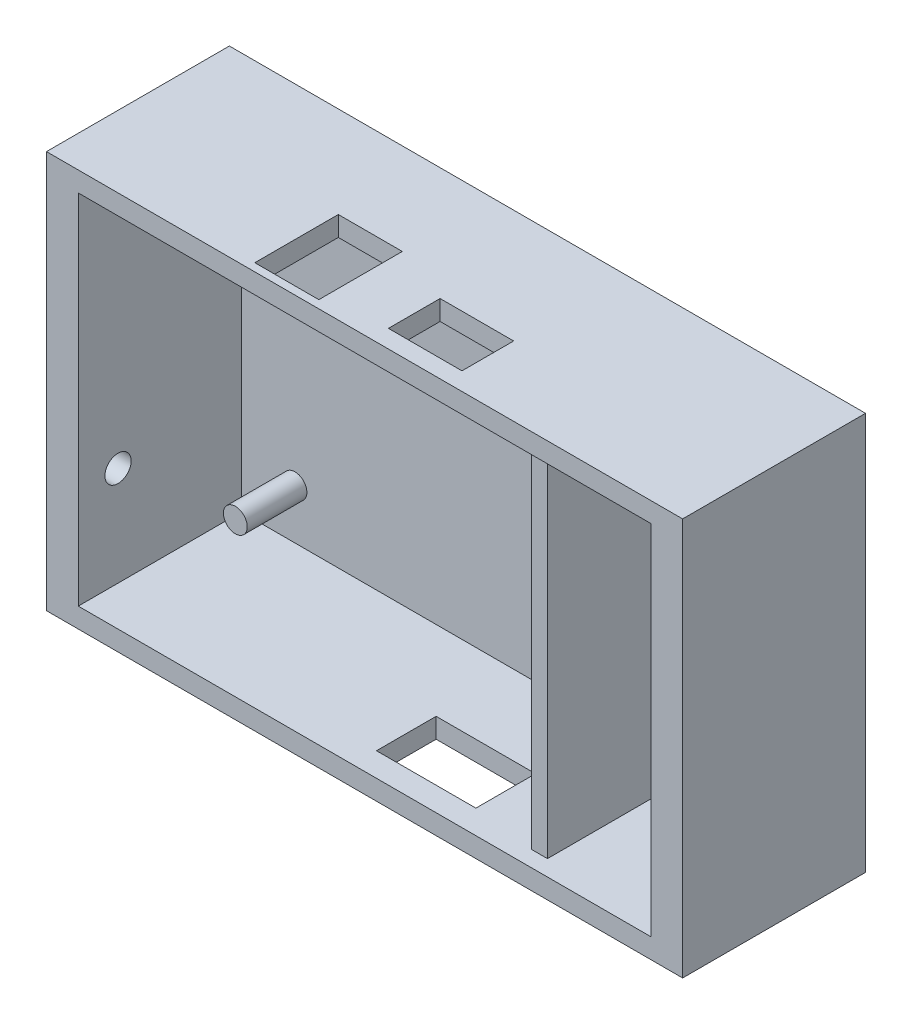
from build123d import *

# Parameters (mm, degrees)
ESQUISSE1_W                       = 160
ESQUISSE1_H                       = 100
ESQUISSE1_W_2                     = 144
ESQUISSE1_H_2                     = 90
PROFONDEUR_BOITIER_DEPTH          = 46
ESQUISSE2_W                       = 144
ESQUISSE2_H                       = 90
PROFONDEUR_FOND_DEPTH             = 5
ESQUISSE3_W                       = 4
ESQUISSE3_H                       = 90
S_PARATION_PLATINE_BATTERIE_DEPTH = 42
ESQUISSE7_R                       = 3.3
ANTENNE_LORA_DEPTH                = 92
ESQUISSE8_W                       = 18.5
ESQUISSE8_H                       = 13
INTERRUPTEUR_DEPTH                = 92
ESQUISSE9_R                       = 3
VIS_PLATINE_DEPTH                 = 20
ESQUISSE10_W                      = 16.1
ESQUISSE10_H                      = 21
DHT22_DEPTH                       = 92
ESQUISSE11_W                      = 25
ESQUISSE11_H                      = 15
DB9_DEPTH                         = 92


with BuildPart() as part:
    # Esquisse1 → profondeur boitier (new body)
    with BuildSketch(Plane.XY):
        Rectangle(ESQUISSE1_W, ESQUISSE1_H)
        Rectangle(ESQUISSE1_W_2, ESQUISSE1_H_2, mode=Mode.SUBTRACT)
    extrude(amount=PROFONDEUR_BOITIER_DEPTH)

    # Esquisse2 → profondeur fond (add)
    with BuildSketch(Plane.XY):
        Rectangle(ESQUISSE2_W, ESQUISSE2_H)
    extrude(amount=PROFONDEUR_FOND_DEPTH)

    # Esquisse3 → Séparation platine batterie (add)
    with BuildSketch(Plane.XY):
        with Locations((40, 0)):
            Rectangle(ESQUISSE3_W, ESQUISSE3_H)
    extrude(amount=S_PARATION_PLATINE_BATTERIE_DEPTH)

    # Esquisse7 → Antenne LoRA (cut)
    with BuildSketch(Plane(origin=(0, 0, 0), x_dir=(0, 0, -1), z_dir=(1, 0, 0))):
        with Locations((-36, -20)):
            Circle(ESQUISSE7_R)
    extrude(amount=-ANTENNE_LORA_DEPTH, mode=Mode.SUBTRACT)

    # Esquisse8 → interrupteur (cut)
    with BuildSketch(Plane(origin=(0, 0, 0), x_dir=(1, 0, 0), z_dir=(0, 1, 0))):
        with Locations((10.75, -35)):
            Rectangle(ESQUISSE8_W, ESQUISSE8_H)
    extrude(amount=INTERRUPTEUR_DEPTH, mode=Mode.SUBTRACT)

    # Esquisse9 → Vis platine (add)
    with BuildSketch(Plane.XY):
        with Locations((-58.5, -32.5)):
            Circle(ESQUISSE9_R)
        with Locations((24.5, -32.5)):
            Circle(ESQUISSE9_R)
        with Locations((24.5, 32.5)):
            Circle(ESQUISSE9_R)
        with Locations((-58.5, 32.5)):
            Circle(ESQUISSE9_R)
    extrude(amount=VIS_PLATINE_DEPTH)

    # Esquisse10 → DHT22 (cut)
    with BuildSketch(Plane(origin=(0, 0, 0), x_dir=(1, 0, 0), z_dir=(0, 1, 0))):
        with Locations((-21.55, -33.5)):
            Rectangle(ESQUISSE10_W, ESQUISSE10_H)
    extrude(amount=DHT22_DEPTH, mode=Mode.SUBTRACT)

    # Esquisse11 → DB9 (cut)
    with BuildSketch(Plane(origin=(0, 0, 0), x_dir=(1, 0, 0), z_dir=(0, 1, 0))):
        with Locations((9.5, -32.5)):
            Rectangle(ESQUISSE11_W, ESQUISSE11_H)
    extrude(amount=-DB9_DEPTH, mode=Mode.SUBTRACT)


solid = part.part
